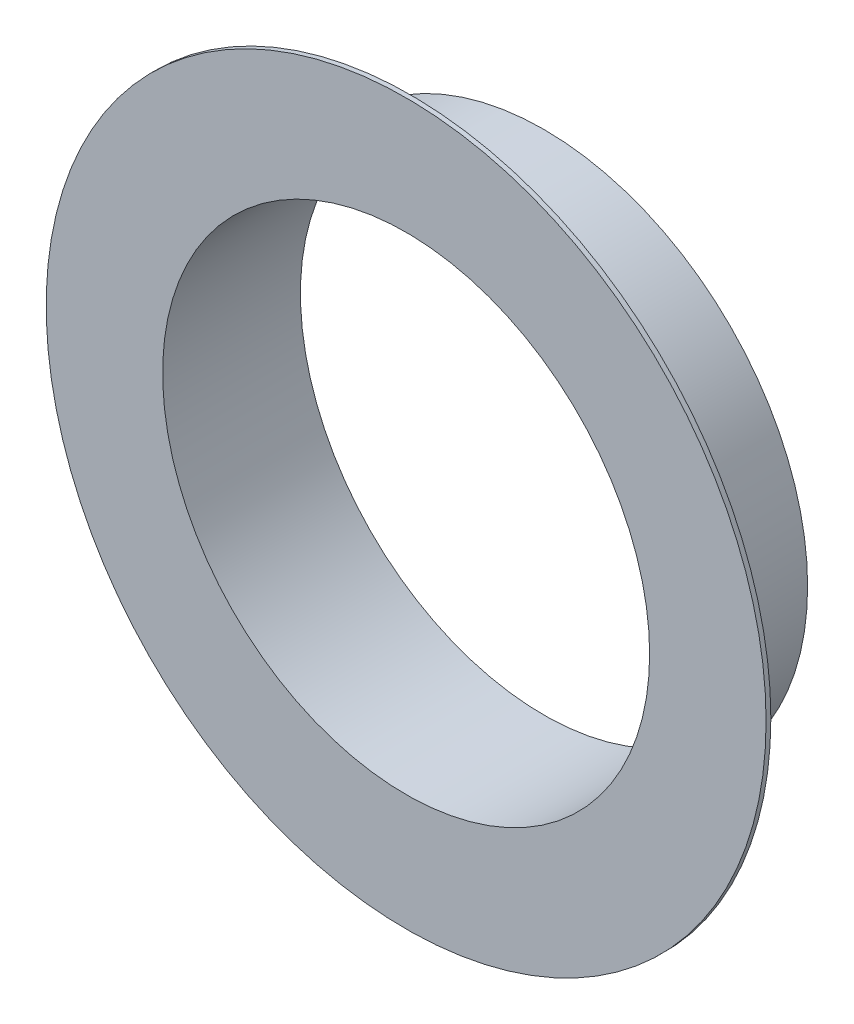
from build123d import *

# Parameters (mm, degrees)
SKETCH1_R           = 111
SKETCH1_R_2         = 102.5
BOSS_EXTRUDE1_DEPTH = 56
SKETCH2_R           = 2.544731427
CUT_EXTRUDE1_DEPTH  = 15
CIRPATTERN1_COUNT   = 8
SKETCH3_R           = 151.521158387
SKETCH3_R_2         = 102.5
BOSS_EXTRUDE2_DEPTH = 2


with BuildPart() as part:
    # Sketch1 → Boss-Extrude1 (new body)
    with BuildSketch(Plane.XY):
        Circle(SKETCH1_R)
        Circle(SKETCH1_R_2, mode=Mode.SUBTRACT)
    extrude(amount=BOSS_EXTRUDE1_DEPTH)

    # Sketch2 → Cut-Extrude1 (cut)
    with BuildSketch(Plane.XY.offset(56)):
        with Locations((29.439514058, 102.263864137)):
            Circle(SKETCH2_R)
    cut_extrude1 = extrude(amount=-CUT_EXTRUDE1_DEPTH, mode=Mode.SUBTRACT)

    # CirPattern1: Cut-Extrude1 ×8 about axis
    cirpattern1_axis = Axis((0, 0, 0), (0, 0, 1))
    for i in range(1, CIRPATTERN1_COUNT):
        add(cut_extrude1.rotate(cirpattern1_axis, i * 360 / CIRPATTERN1_COUNT), mode=Mode.SUBTRACT)

    # Sketch3 → Boss-Extrude2 (add)
    with BuildSketch(Plane.XY.offset(56)):
        Circle(SKETCH3_R)
        Circle(SKETCH3_R_2, mode=Mode.SUBTRACT)
    extrude(amount=BOSS_EXTRUDE2_DEPTH)


solid = part.part
